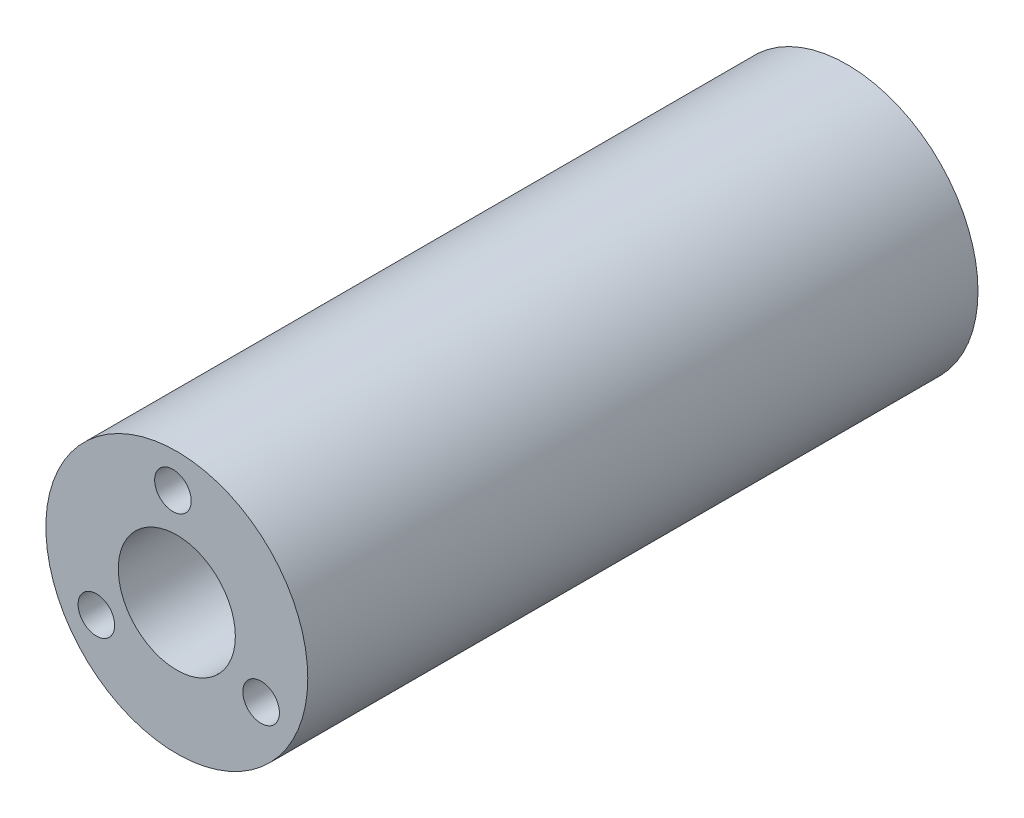
from build123d import *

# Parameters (mm, degrees)
SKETCH1_R           = 8.95
SKETCH1_R_2         = 1.25
SKETCH1_R_3         = 4
BOSS_EXTRUDE1_DEPTH = 45.8


with BuildPart() as part:
    # Sketch1 → Boss-Extrude1 (new body)
    with BuildSketch(Plane.XY):
        Circle(SKETCH1_R)
        with Locations((-0.265065705, 6.5)):
            Circle(SKETCH1_R_2, mode=Mode.SUBTRACT)
        with Locations((-5.496632272, -3.479553634)):
            Circle(SKETCH1_R_2, mode=Mode.SUBTRACT)
        with Locations((5.761697977, -3.020446366)):
            Circle(SKETCH1_R_2, mode=Mode.SUBTRACT)
        Circle(SKETCH1_R_3, mode=Mode.SUBTRACT)
    extrude(amount=BOSS_EXTRUDE1_DEPTH)


solid = part.part
